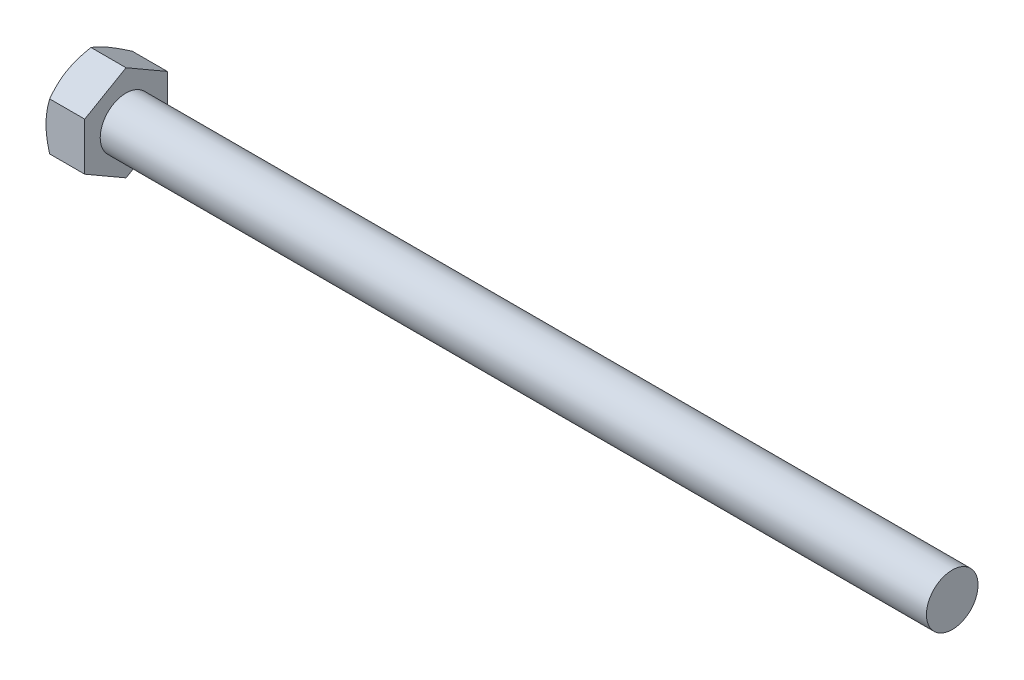
from build123d import *

# Parameters (mm, degrees)
SKETCH2_R     = 9.330254042
HEX_DIE_DEPTH = 7.5
SKETCH4_R     = 7
INDENT_DEPTH  = 0.9375


with BuildPart() as part:
    # BodySke → Base-Revolve (revolve)
    with BuildSketch(Plane.XY, mode=Mode.PRIVATE) as base_revolve_sk:
        Polygon((7.5, 5), (7.5, 9.237875289), (0.714687631, 9.237875289), (0, 8), (0, 0), (167.5, 0), (167.5, 5), align=None)
    revolve(base_revolve_sk.sketch.rotate(Axis((-25.4, 0, 0), (1, 0, 0)), 90), axis=Axis((-25.4, 0, 0), (1, 0, 0)))

    # Sketch2 → Hex-Die (cut)
    with BuildSketch(Plane(origin=(0, 0, 0), x_dir=(0, 0, -1), z_dir=(1, 0, 0))):
        Circle(SKETCH2_R)
        Polygon((-8, 4.618802174), (0, 9.237604347), (8, 4.618802174), (8, -4.618802174), (0, -9.237604347), (-8, -4.618802174), align=None, mode=Mode.SUBTRACT)
    extrude(amount=HEX_DIE_DEPTH, mode=Mode.SUBTRACT)

    # Sketch4 → Indent (cut)
    with BuildSketch(Plane(origin=(0, 0, 0), x_dir=(0, 0, -1), z_dir=(1, 0, 0))):
        Circle(SKETCH4_R)
    extrude(amount=INDENT_DEPTH, mode=Mode.SUBTRACT)


solid = part.part
